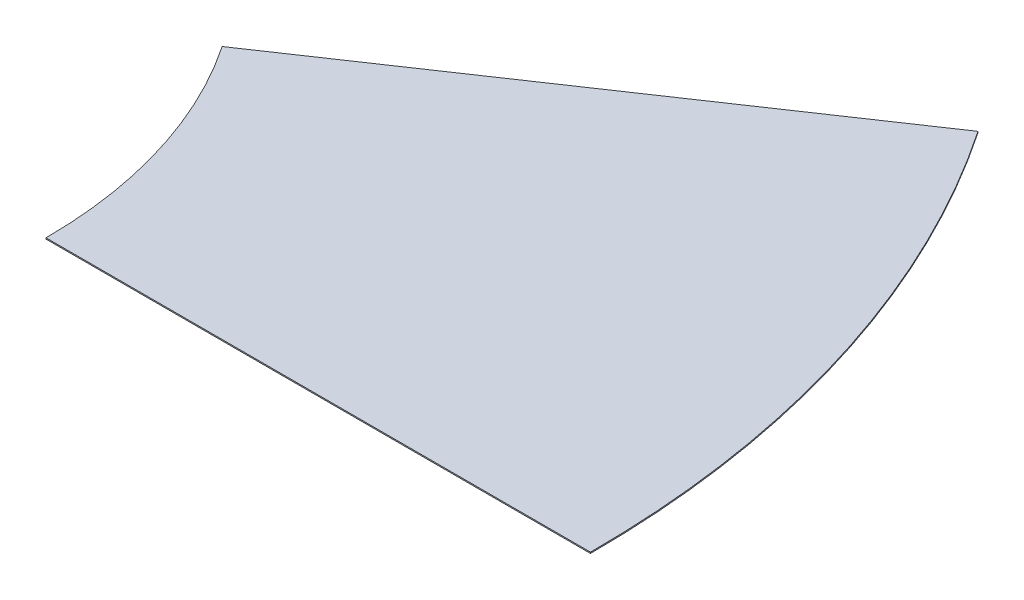
from build123d import *

# Parameters (mm, degrees)
EXTRUDE_1_DEPTH = 0.13


with BuildPart() as part:
    # 草图1 → 凸台-拉伸1 (new body)
    with BuildSketch(Plane(origin=(0, 0, 0), x_dir=(1, 0, 0), z_dir=(0, 1, 0))):
        with BuildLine():
            Line((91.194132981, 61.511219382), (41.451878628, 27.959645174))
            ThreePointArc((41.451878628, 27.959645174), (47.815237798, 14.618585236), (50, 0))
            Line((50, 0), (110, 0))
            ThreePointArc((110, 0), (105.193523156, 32.16088752), (91.194132981, 61.511219382))
        make_face()
    extrude(amount=EXTRUDE_1_DEPTH)


solid = part.part
